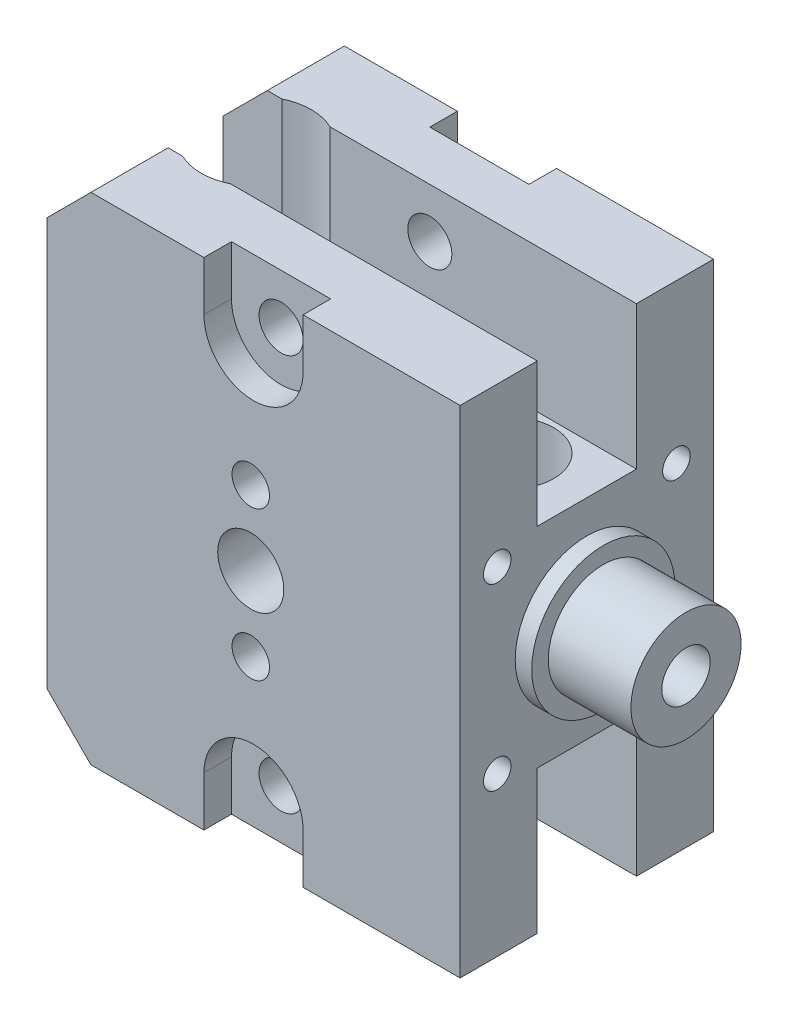
from build123d import *

# Parameters (mm, degrees)
SKETCH2_W                     = 75
SKETCH2_H                     = 90
BOSS_EXTRUDE1_DEPTH           = 23
SKETCH3_W                     = 18
SKETCH3_H                     = 26
CUT_EXTRUDE1_DEPTH            = 91.437823946
SKETCH4_R                     = 10
BOSS_EXTRUDE2_DEPTH           = 18
SKETCH5_R                     = 13
BOSS_EXTRUDE3_DEPTH           = 3
F_12_0_12_DIAMETER_HOLE1_D    = 12
CUT_EXTRUDE2_DEPTH            = 5
F_8_0_8_DIAMETER_HOLE1_D      = 8
M8_TAPPED_HOLE1_D             = 6.8
SKETCH17_R                    = 8
CUT_EXTRUDE3_DEPTH            = 38
F_8_0_8_DIAMETER_HOLE2_D      = 8
CHAMFER1_SIZE                 = 8
G1_8_TAPPED_HOLE1_D           = 8.8
G1_8_TAPPED_HOLE1_DEPTH       = 14
G1_8_TAPPED_HOLE1_TIP         = 2.643786724
F_2_0_2_DIAMETER_HOLE1_REACH  = 107.844
F_2_0_2_DIAMETER_HOLE1_BORE_R = 1
M6_TAPPED_HOLE1_REACH         = 107.844
M6_TAPPED_HOLE1_BORE_R        = 2.5
CIRPATTERN1_COUNT             = 4
SKETCH36_R                    = 10
CUT_EXTRUDE5_DEPTH            = 38
M8_TAPPED_HOLE2_D             = 6.8
M8_TAPPED_HOLE2_CSINK_D       = 8.05
M8_TAPPED_HOLE2_CSINK_ANGLE   = 90


with BuildPart() as part:
    # Sketch2 → Boss-Extrude1 (new, symmetric)
    with BuildSketch(Plane.XY):
        with Locations((0.5, 0)):
            Rectangle(SKETCH2_W, SKETCH2_H)
    extrude(amount=BOSS_EXTRUDE1_DEPTH, both=True)

    # Sketch3 → Cut-Extrude1 (cut, through all)
    with BuildSketch(Plane(origin=(38, 0, 0), x_dir=(0, 0, -1), z_dir=(1, 0, 0))):
        with Locations((0, -32)):
            Rectangle(SKETCH3_W, SKETCH3_H)
        with Locations((0, 32)):
            Rectangle(SKETCH3_W, SKETCH3_H)
    extrude(amount=-CUT_EXTRUDE1_DEPTH, mode=Mode.SUBTRACT)

    # Sketch4 → Boss-Extrude2 (add)
    with BuildSketch(Plane(origin=(38, 0, 0), x_dir=(0, 0, -1), z_dir=(1, 0, 0))):
        with Locations(Location((0, 0, 0), (0, 0, 180))):
            Circle(SKETCH4_R)
    extrude(amount=BOSS_EXTRUDE2_DEPTH)

    # Sketch5 → Boss-Extrude3 (add)
    with BuildSketch(Plane(origin=(38, 0, 0), x_dir=(0, 0, -1), z_dir=(1, 0, 0))):
        with Locations(Location((0, 0, 0), (0, 0, 180))):
            Circle(SKETCH5_R)
    extrude(amount=BOSS_EXTRUDE3_DEPTH)

    # Ø12.0 (12) Diameter Hole1 (through all)
    with Locations(Plane(origin=(0, 0, -23), x_dir=(-1, 0, 0), z_dir=(0, 0, -1))):
        with Locations((0, 0)):
            Hole(F_12_0_12_DIAMETER_HOLE1_D / 2)

    # Sketch9 → Cut-Extrude2 (cut)
    with BuildSketch(Plane(origin=(0, 0, -23), x_dir=(-1, 0, 0), z_dir=(0, 0, -1))):
        with BuildLine():
            Line((-9.5, -45), (-9.5, -36))
            ThreePointArc((-9.5, -36), (-0.5, -27), (8.5, -36))
            Line((8.5, -36), (8.5, -45))
            ThreePointArc((8.5, -45), (-0.5, -54), (-9.5, -45))
        make_face()
        with BuildLine():
            Line((-9.5, 45), (-9.5, 36))
            ThreePointArc((-9.5, 36), (-0.5, 27), (8.5, 36))
            Line((8.5, 36), (8.5, 45))
            ThreePointArc((8.5, 45), (-0.5, 54), (-9.5, 45))
        make_face()
    cut_extrude2 = extrude(amount=-CUT_EXTRUDE2_DEPTH, mode=Mode.SUBTRACT)

    # Mirror1: Cut-Extrude2 across plane
    add(cut_extrude2.mirror(Plane.XY), mode=Mode.SUBTRACT)

    # Ø8.0 (8) Diameter Hole1 (through all)
    with Locations(Plane(origin=(0, 0, -18), x_dir=(-1, 0, 0), z_dir=(0, 0, -1))):
        with Locations((-0.5, -36), (-0.5, 36)):
            Hole(F_8_0_8_DIAMETER_HOLE1_D / 2)

    # M8 Tapped Hole1 (through all)
    with Locations(Plane(origin=(0, 0, -23), x_dir=(-1, 0, 0), z_dir=(0, 0, -1))):
        with Locations((0, 13.5), (0, -13.5)):
            Hole(M8_TAPPED_HOLE1_D / 2)

    # Sketch17 → Cut-Extrude3 (cut)
    with BuildSketch(Plane(origin=(0, 45, 0), x_dir=(1, 0, 0), z_dir=(0, 1, 0))):
        with Locations(Location((24, 0, 0), (0, 0, 180))):
            Circle(SKETCH17_R)
    cut_extrude3 = extrude(amount=-CUT_EXTRUDE3_DEPTH, mode=Mode.SUBTRACT)

    # Mirror2: Cut-Extrude3 across plane
    add(cut_extrude3.mirror(Plane.ZX), mode=Mode.SUBTRACT)

    # Ø8.0 (8) Diameter Hole2 (through all)
    with Locations(Plane(origin=(0, 7, 0), x_dir=(1, 0, 0), z_dir=(0, 1, 0))):
        with Locations((24, 0)):
            Hole(F_8_0_8_DIAMETER_HOLE2_D / 2)

    # Chamfer1
    chamfer1_edges = [part.edges().sort_by_distance(p)[0] for p in [
        (-37, 45, -16),
        (-37, -45, -16),
        (-37, 45, 16),
        (-37, -45, 16),
    ]]
    chamfer(chamfer1_edges, length=CHAMFER1_SIZE)

    # G1/8 Tapped Hole1
    with Locations(Plane(origin=(56, 0, 0), x_dir=(0, 0, -1), z_dir=(1, 0, 0))):
        with Locations((0, 0)):
            Hole(G1_8_TAPPED_HOLE1_D / 2, depth=G1_8_TAPPED_HOLE1_DEPTH)
            with Locations((0, 0, -(G1_8_TAPPED_HOLE1_DEPTH + G1_8_TAPPED_HOLE1_TIP / 2))):  # 118° drill point
                Cone(0, G1_8_TAPPED_HOLE1_D / 2, G1_8_TAPPED_HOLE1_TIP, mode=Mode.SUBTRACT)

    # Ø2.0 (2) Diameter Hole1 bore → Ø2.0 (2) Diameter Hole1 (cut, up to next)
    with BuildSketch(Plane(origin=(56, 0, 0), x_dir=(0, 0, -1), z_dir=(1, 0, 0)), mode=Mode.PRIVATE) as f_2_0_2_diameter_hole1_sk1:
        Circle(F_2_0_2_DIAMETER_HOLE1_BORE_R)
    f_2_0_2_diameter_hole1_tool1 = extrude(f_2_0_2_diameter_hole1_sk1.sketch, amount=-F_2_0_2_DIAMETER_HOLE1_REACH, mode=Mode.PRIVATE) & part.part
    add(f_2_0_2_diameter_hole1_tool1.solids().sort_by_distance((56, 0, 0))[0], mode=Mode.SUBTRACT)

    # M6 Tapped Hole1 bore → M6 Tapped Hole1 (cut, up to next)
    with BuildSketch(Plane.ZY.offset(37), mode=Mode.PRIVATE) as m6_tapped_hole1_sk1:
        Circle(M6_TAPPED_HOLE1_BORE_R)
    m6_tapped_hole1_tool1 = extrude(m6_tapped_hole1_sk1.sketch, amount=-M6_TAPPED_HOLE1_REACH, mode=Mode.PRIVATE) & part.part
    add(m6_tapped_hole1_tool1.solids().sort_by_distance((-37, 0, 0))[0], mode=Mode.SUBTRACT)

    # Sketch34 → M6 Tapped Hole2 (revolve, cut)
    with BuildSketch(Plane(origin=(38, 16.263455967, 16.263455967), x_dir=(0, 0, -1), z_dir=(0, 1, 0))):
        Polygon((0, 0), (0, 16.502151548), (2.5, 15), (2.5, 0), align=None)
    m6_tapped_hole2 = revolve(axis=Axis((44.35, 16.263455967, 16.263455967), (-1, 0, 0)), mode=Mode.SUBTRACT)

    # CirPattern1: M6 Tapped Hole2 ×4 about axis
    cirpattern1_axis = Axis((0, 0, 0), (1, 0, 0))
    for i in range(1, CIRPATTERN1_COUNT):
        add(m6_tapped_hole2.rotate(cirpattern1_axis, i * 360 / CIRPATTERN1_COUNT), mode=Mode.SUBTRACT)

    # Sketch36 → Cut-Extrude5 (cut)
    with BuildSketch(Plane.XZ.offset(45)):
        with Locations((-22, 0)):
            Circle(SKETCH36_R)
    cut_extrude5 = extrude(amount=-CUT_EXTRUDE5_DEPTH, mode=Mode.SUBTRACT)

    # Mirror4: Cut-Extrude5 across plane
    add(cut_extrude5.mirror(Plane.ZX), mode=Mode.SUBTRACT)

    # M8 Tapped Hole2 (through all)
    with Locations(Plane(origin=(0, -7, 0), x_dir=(-1, 0, 0), z_dir=(0, -1, 0))):
        with Locations((22, 0)):
            CounterSinkHole(M8_TAPPED_HOLE2_D / 2, M8_TAPPED_HOLE2_CSINK_D / 2, counter_sink_angle=M8_TAPPED_HOLE2_CSINK_ANGLE)


solid = part.part
